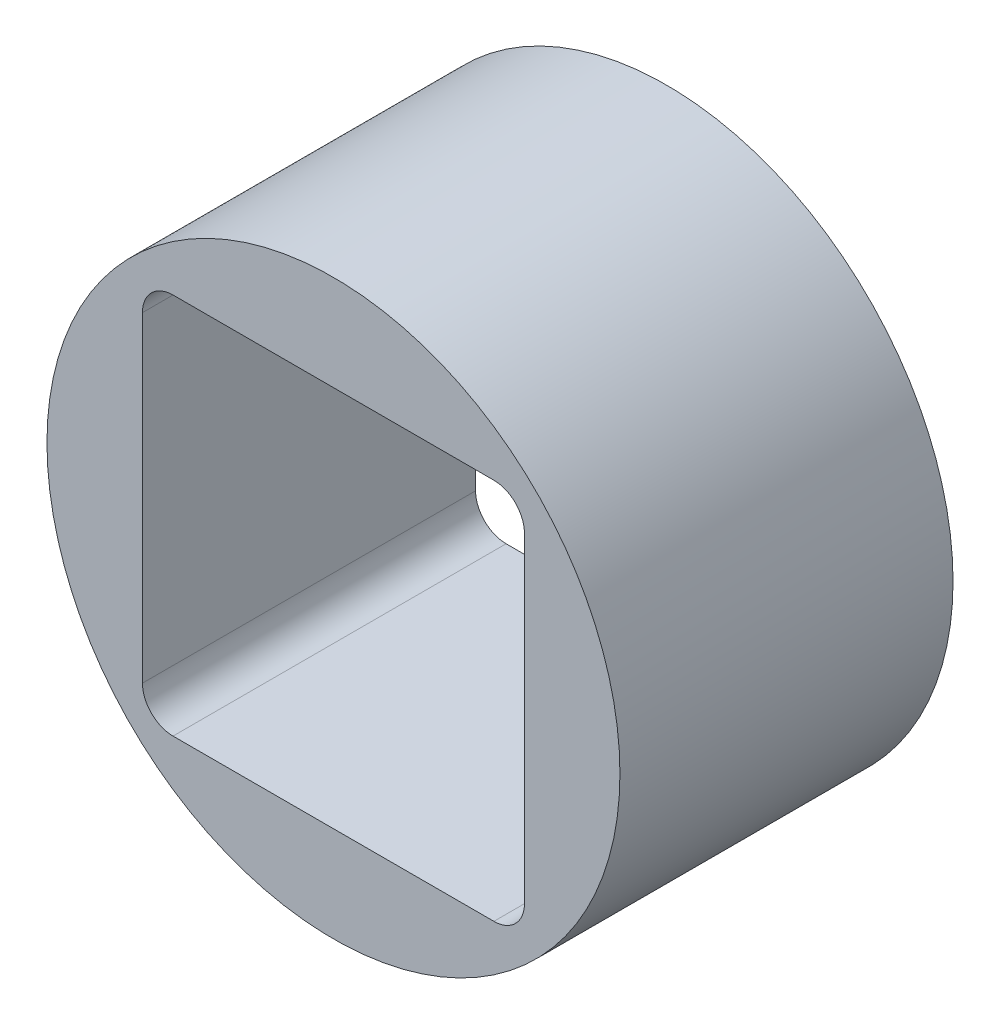
from build123d import *

# Parameters (mm, degrees)
SKETCH1_R           = 4.7625
BOSS_EXTRUDE1_DEPTH = 5.5372


with BuildPart() as part:
    # Sketch1 → Boss-Extrude1 (new body)
    with BuildSketch(Plane.XY):
        Circle(SKETCH1_R)
        with BuildLine():
            Line((-2.667, 3.175), (2.667, 3.175))
            ThreePointArc((2.667, 3.175), (3.026210245, 3.026210245), (3.175, 2.667))
            Line((3.175, 2.667), (3.175, -2.667))
            ThreePointArc((3.175, -2.667), (3.026210245, -3.026210245), (2.667, -3.175))
            Line((2.667, -3.175), (-2.667, -3.175))
            ThreePointArc((-2.667, -3.175), (-3.026210245, -3.026210245), (-3.175, -2.667))
            Line((-3.175, -2.667), (-3.175, 2.667))
            ThreePointArc((-3.175, 2.667), (-3.026210245, 3.026210245), (-2.667, 3.175))
        make_face(mode=Mode.SUBTRACT)
    extrude(amount=BOSS_EXTRUDE1_DEPTH)


solid = part.part
